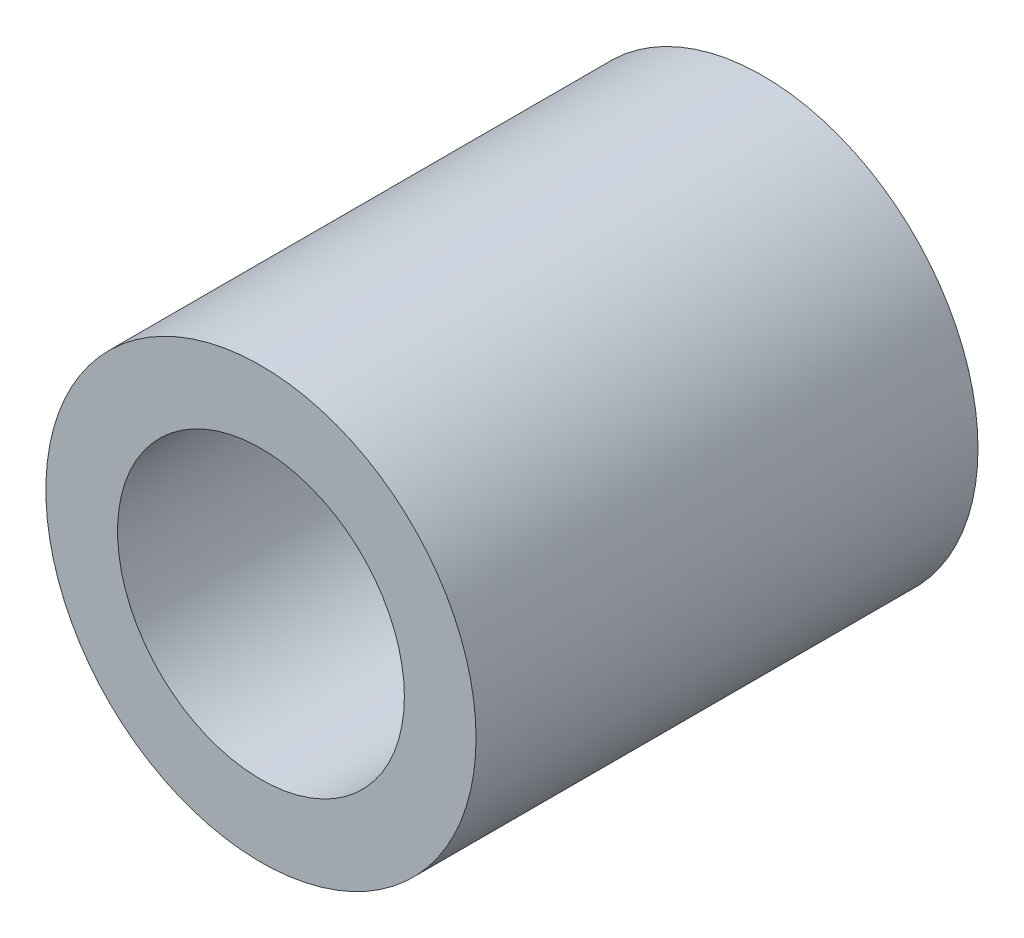
from build123d import *

# Parameters (mm, degrees)
ESQUISSE1_R        = 3
ESQUISSE1_R_2      = 2
BOSS_EXTRU_1_DEPTH = 7


with BuildPart() as part:
    # Esquisse1 → Boss.-Extru.1 (new body)
    with BuildSketch(Plane.XY):
        Circle(ESQUISSE1_R)
        Circle(ESQUISSE1_R_2, mode=Mode.SUBTRACT)
    extrude(amount=BOSS_EXTRU_1_DEPTH)


solid = part.part
